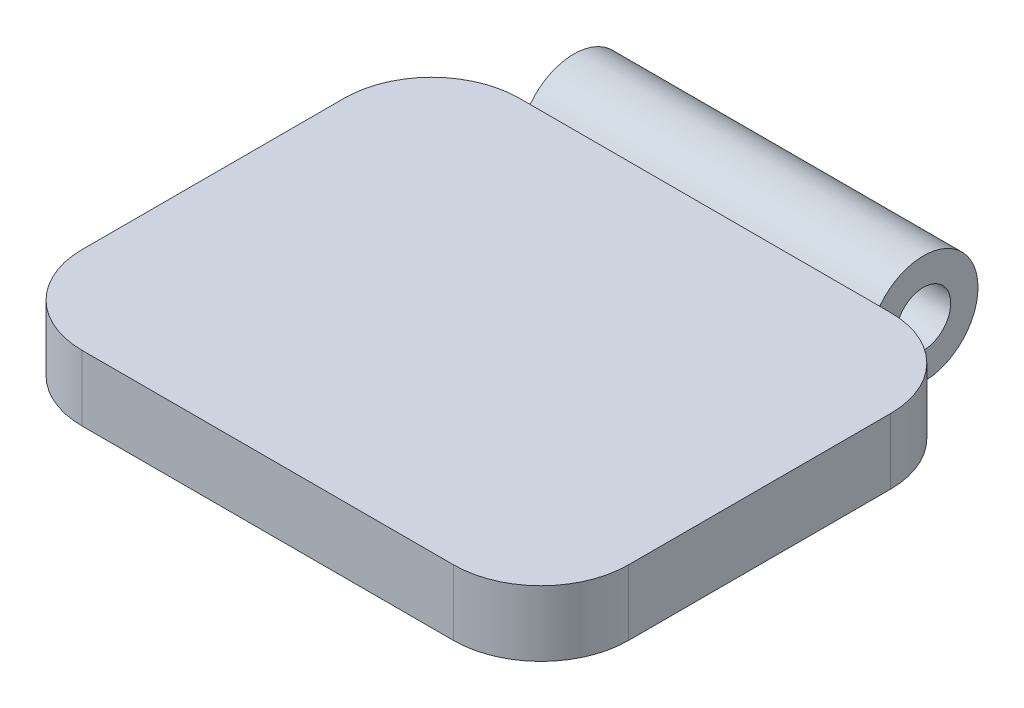
from build123d import *

# Parameters (mm, degrees)
SKETCH2_W           = 25
SKETCH2_H           = 20
BOSS_EXTRUDE1_DEPTH = 3
FILLET1_R           = 4
SKETCH4_R           = 2.5
BOSS_EXTRUDE2_DEPTH = 8
SKETCH5_R           = 1.25
CUT_EXTRUDE1_DEPTH  = 16


with BuildPart() as part:
    # Sketch2 → Boss-Extrude1 (new body)
    with BuildSketch(Plane(origin=(0, 0, 0), x_dir=(1, 0, 0), z_dir=(0, 1, 0))):
        Rectangle(SKETCH2_W, SKETCH2_H)
    extrude(amount=BOSS_EXTRUDE1_DEPTH)

    # Fillet1
    fillet1_edges = [part.edges().sort_by_distance(p)[0] for p in [
        (12.5, 1.5, 10),
        (-12.5, 1.5, 10),
        (-12.5, 1.5, -10),
        (12.5, 1.5, -10),
    ]]
    fillet(fillet1_edges, radius=FILLET1_R)

    # Sketch4 → Boss-Extrude2 (add, symmetric)
    with BuildSketch(Plane(origin=(0, 0, 0), x_dir=(0, 0, -1), z_dir=(1, 0, 0))):
        with Locations((12, 1.5)):
            Circle(SKETCH4_R)
    extrude(amount=BOSS_EXTRUDE2_DEPTH, both=True)

    # Sketch5 → Cut-Extrude1 (cut)
    with BuildSketch(Plane(origin=(8, 0, 0), x_dir=(0, 0, -1), z_dir=(1, 0, 0))):
        with Locations((12, 1.5)):
            Circle(SKETCH5_R)
    extrude(amount=-CUT_EXTRUDE1_DEPTH, mode=Mode.SUBTRACT)


solid = part.part
